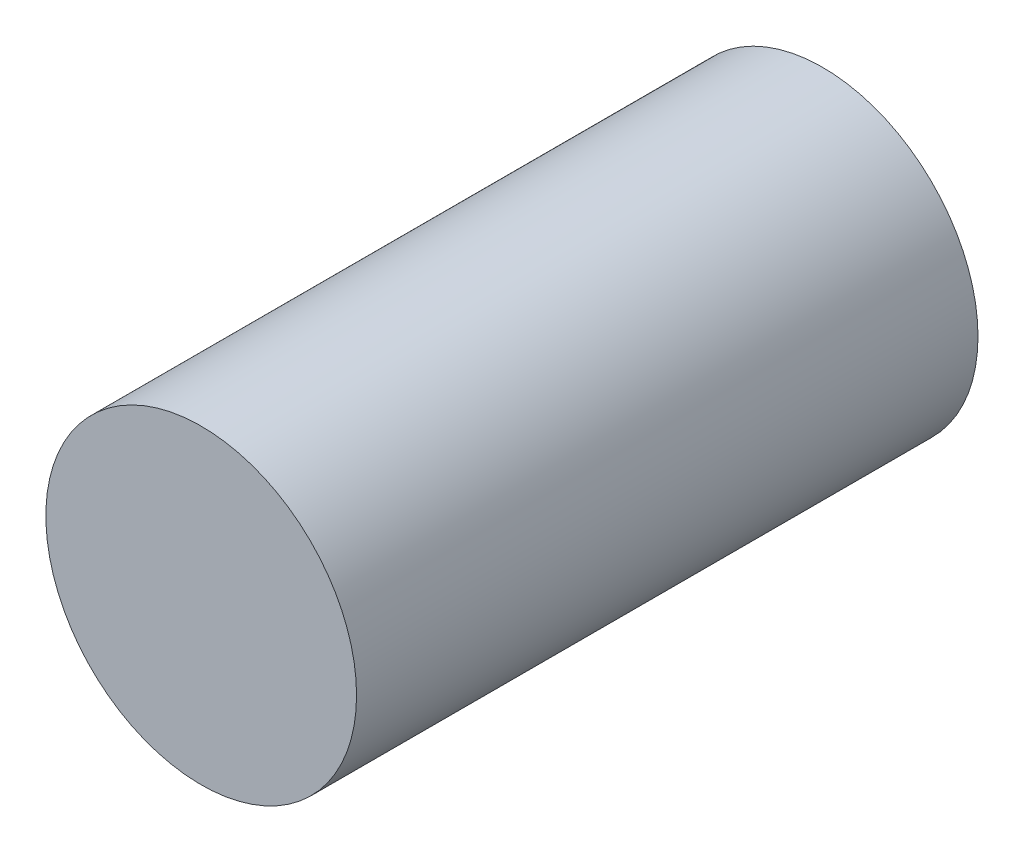
from build123d import *

# Parameters (mm, degrees)
SKETCH1_R           = 25
BOSS_EXTRUDE1_DEPTH = 100


with BuildPart() as part:
    # Sketch1 → Boss-Extrude1 (new body)
    with BuildSketch(Plane.XY):
        Circle(SKETCH1_R)
    extrude(amount=BOSS_EXTRUDE1_DEPTH)


solid = part.part
